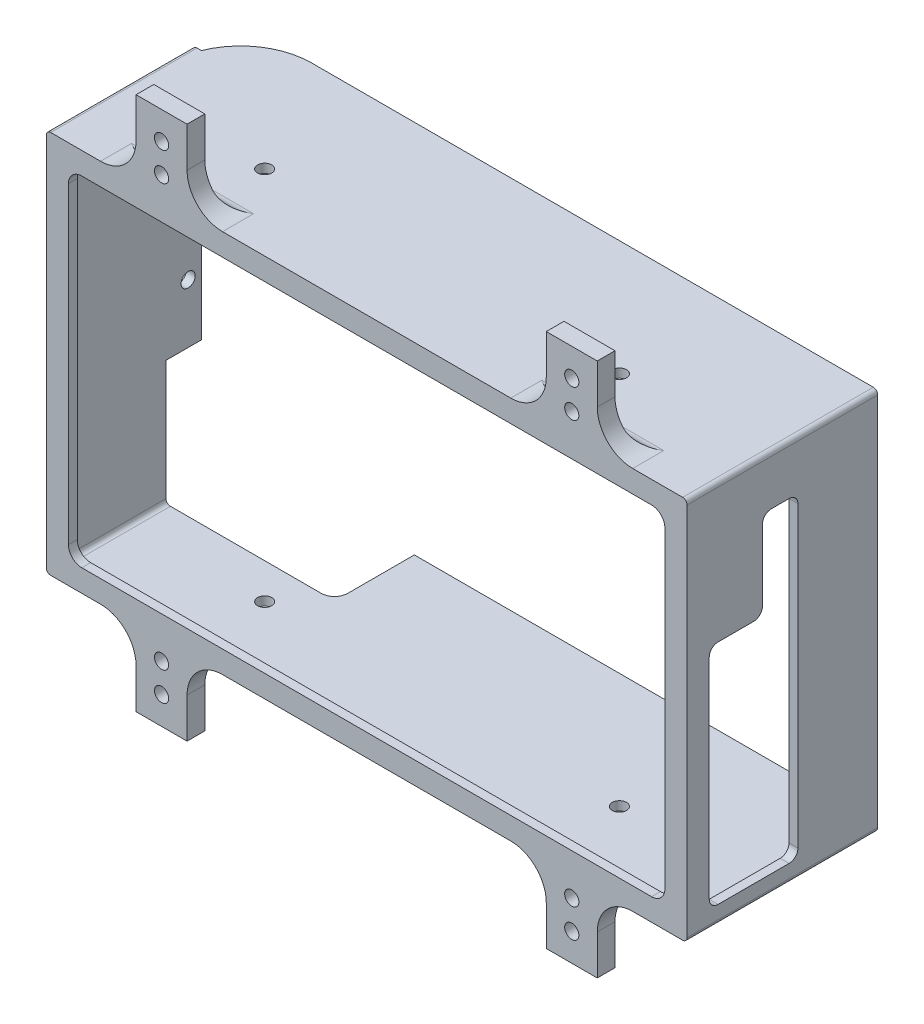
from build123d import *

# Parameters (mm, degrees)
SKETCH_1_W           = 140.5
SKETCH_1_H           = 82.5
EXTRUDE_1_DEPTH      = 2
EXTRUDE_3_DEPTH      = 41
EXTRUDE_3_DEPTH_BACK = 2
SKETCH_6_W           = 144.5
SKETCH_6_H           = 86.5
SKETCH_6_W_2         = 140.5
SKETCH_6_H_2         = 82.5
FILLET_2_R           = 1
FILLET_3_R           = 1
SKETCH_9_R           = 1.6
SKETCH_9_R_2         = 2.1
CUT_EXTRUDE_3_DEPTH  = 95.549590163
CUT_EXTRUDE_4_DEPTH  = 120.930448594
CUT_EXTRUDE_5_REACH  = 158.307
SKETCH_12_R          = 1.6
SKETCH_13_R          = 1.6
CUT_EXTRUDE_6_DEPTH  = 120.9304487
CUT_EXTRUDE_7_DEPTH  = 10
CUT_EXTRUDE_8_REACH  = 158.307
FILLET_4_R           = 2
SKETCH_18_W          = 11.5
SKETCH_18_H          = 17
EXTRUDE_4_DEPTH      = 4
CUT_EXTRUDE_9_REACH  = 103.839
SKETCH_19_R          = 1.6
CUT_EXTRUDE_11_REACH = 134.715
FILLET_5_R           = 8
FILLET_6_R           = 3
SKETCH_21_W          = 21.379411067
SKETCH_21_H          = 30
CUT_EXTRUDE_12_DEPTH = 8


with BuildPart() as part:
    # 草图1 → 凸台-拉伸1 (new body)
    with BuildSketch(Plane.XY):
        Rectangle(SKETCH_1_W, SKETCH_1_H)
    extrude(amount=EXTRUDE_1_DEPTH)

    # 草图6 → 凸台-拉伸3 (add, two sides: drawn at the far end of the back side and taken through both)
    with BuildSketch(Plane(origin=(0, 0, 0), x_dir=(-1, 0, 0), z_dir=(0, 0, -1)).offset(-EXTRUDE_3_DEPTH_BACK)):
        Rectangle(SKETCH_6_W, SKETCH_6_H)
        Rectangle(SKETCH_6_W_2, SKETCH_6_H_2, mode=Mode.SUBTRACT)
    extrude(amount=EXTRUDE_3_DEPTH + EXTRUDE_3_DEPTH_BACK)

    # 圆角2
    fillet_2_edges = [part.edges().sort_by_distance(p)[0] for p in [
        (70.25, -41.25, -20.5),
        (70.25, 41.25, -20.5),
        (-70.25, 41.25, -20.5),
        (-70.25, -41.25, -20.5),
    ]]
    fillet(fillet_2_edges, radius=FILLET_2_R)

    # 圆角3
    fillet_3_edges = [part.edges().sort_by_distance(p)[0] for p in [
        (72.25, 43.25, -19.5),
        (-72.25, 43.25, -19.5),
        (-72.25, -43.25, -19.5),
        (72.25, -43.25, -19.5),
    ]]
    fillet(fillet_3_edges, radius=FILLET_3_R)

    # 草图9 → 切除-拉伸3 (cut, through all)
    with BuildSketch(Plane.XY.offset(2)):
        with Locations((26.5, -17.5)):
            Circle(SKETCH_9_R)
        with Locations((0, -17.5)):
            Circle(SKETCH_9_R)
        with Locations((-10.5, -17)):
            Circle(SKETCH_9_R_2)
        with Locations((-26.5, -17.5)):
            Circle(SKETCH_9_R)
        with Locations((-26.5, 0)):
            Circle(SKETCH_9_R)
        with Locations((-10.5, 0)):
            Circle(SKETCH_9_R_2)
        with Locations((26.5, 0)):
            Circle(SKETCH_9_R)
        with Locations((10.5, 0)):
            Circle(SKETCH_9_R_2)
        with Locations((26.5, 17.5)):
            Circle(SKETCH_9_R)
        with Locations((0, 17.5)):
            Circle(SKETCH_9_R)
        with Locations((-10.5, 17)):
            Circle(SKETCH_9_R_2)
        with Locations((-26.5, 17.5)):
            Circle(SKETCH_9_R)
        Circle(SKETCH_9_R)
    extrude(amount=-CUT_EXTRUDE_3_DEPTH, mode=Mode.SUBTRACT)

    # 草图10 → 切除-拉伸4 (cut, through all)
    with BuildSketch(Plane(origin=(0, 43.25, 0), x_dir=(1, 0, 0), z_dir=(0, 1, 0))):
        with BuildLine():
            Line((-72.25, 31), (-72.25, 41))
            Line((-72.25, 41), (-55.417603026, 41))
            ThreePointArc((-55.417603026, 41), (-64.361874936, 38.266499161), (-70.25, 31))
            Line((-70.25, 31), (-72.25, 31))
        make_face()
    extrude(amount=-CUT_EXTRUDE_4_DEPTH, mode=Mode.SUBTRACT)

    # 草图12 → 切除-拉伸5 (cut, up to next)
    with BuildSketch(Plane.ZY.offset(72.25), mode=Mode.PRIVATE) as cut_extrude_5_sk1:
        with Locations((-28, 0)):
            Circle(SKETCH_12_R)
    cut_extrude_5_tool1 = extrude(cut_extrude_5_sk1.sketch, amount=-CUT_EXTRUDE_5_REACH, mode=Mode.PRIVATE) & part.part
    add(cut_extrude_5_tool1.solids().sort_by_distance((-72.25, 0, -28))[0], mode=Mode.SUBTRACT)

    # 草图13 → 切除-拉伸6 (cut, through all)
    with BuildSketch(Plane(origin=(0, 43.25, 0), x_dir=(1, 0, 0), z_dir=(0, 1, 0))):
        with Locations(Location((-40, 15, 0), (0, 0, 270))):
            Circle(SKETCH_13_R)
        with Locations(Location((40, 15, 0), (0, 0, 270))):
            Circle(SKETCH_13_R)
    extrude(amount=-CUT_EXTRUDE_6_DEPTH, mode=Mode.SUBTRACT)

    # 草图14 → 切除-拉伸7 (cut)
    with BuildSketch(Plane(origin=(0, 0, 0), x_dir=(-1, 0, 0), z_dir=(0, 0, -1))):
        with BuildLine():
            Line((-64.25, 38.25), (64.25, 38.25))
            ThreePointArc((64.25, 38.25), (66.371320344, 37.371320344), (67.25, 35.25))
            Line((67.25, 35.25), (67.25, -35.25))
            ThreePointArc((67.25, -35.25), (66.371320344, -37.371320344), (64.25, -38.25))
            Line((64.25, -38.25), (-64.25, -38.25))
            ThreePointArc((-64.25, -38.25), (-66.371320344, -37.371320344), (-67.25, -35.25))
            Line((-67.25, -35.25), (-67.25, 35.25))
            ThreePointArc((-67.25, 35.25), (-66.371320344, 37.371320344), (-64.25, 38.25))
        make_face()
    extrude(amount=-CUT_EXTRUDE_7_DEPTH, mode=Mode.SUBTRACT)

    # 草图15 → 切除-拉伸8 (cut, up to next)
    with BuildSketch(Plane(origin=(72.25, 0, 0), x_dir=(0, 0, -1), z_dir=(1, 0, 0)), mode=Mode.PRIVATE) as cut_extrude_8_sk1:
        Polygon((15, 12), (3, 12), (3, -39.25), (23, -39.25), (23, 32), (15, 32), align=None)
    cut_extrude_8_tool1 = extrude(cut_extrude_8_sk1.sketch, amount=-CUT_EXTRUDE_8_REACH, mode=Mode.PRIVATE) & part.part
    add(cut_extrude_8_tool1.solids().sort_by_distance((72.25, -8.814873, -13.810127))[0], mode=Mode.SUBTRACT)

    # 圆角4
    fillet_4_edges = [part.edges().sort_by_distance(p)[0] for p in [
        (71.25, -39.25, -3),
        (71.25, 12, -3),
        (71.25, 12, -15),
        (71.25, 32, -15),
        (71.25, 32, -23),
        (71.25, -39.25, -23),
    ]]
    fillet(fillet_4_edges, radius=FILLET_4_R)

    # 草图18 → 凸台-拉伸4 (add)
    with BuildSketch(Plane.XY.offset(2)):
        with Locations((-46.25, -51.75)):
            Rectangle(SKETCH_18_W, SKETCH_18_H)
        with Locations((46.25, -51.75)):
            Rectangle(SKETCH_18_W, SKETCH_18_H)
        with Locations((46.25, 51.75)):
            Rectangle(SKETCH_18_W, SKETCH_18_H)
        with Locations((-46.25, 51.75)):
            Rectangle(SKETCH_18_W, SKETCH_18_H)
    extrude(amount=-EXTRUDE_4_DEPTH)

    # 草图19 → 切除-拉伸9 (cut, up to next)
    with BuildSketch(Plane(origin=(0, 0, -2), x_dir=(-1, 0, 0), z_dir=(0, 0, -1)), mode=Mode.PRIVATE) as cut_extrude_9_sk1:
        with Locations((46.25, 54)):
            Circle(SKETCH_19_R)
    cut_extrude_9_tool1 = extrude(cut_extrude_9_sk1.sketch, amount=-CUT_EXTRUDE_9_REACH, mode=Mode.PRIVATE) & part.part
    # 草图19 → 切除-拉伸9 (cut, up to next)
    with BuildSketch(Plane(origin=(0, 0, -2), x_dir=(-1, 0, 0), z_dir=(0, 0, -1)), mode=Mode.PRIVATE) as cut_extrude_9_sk2:
        with Locations((46.25, 47.5)):
            Circle(SKETCH_19_R)
    cut_extrude_9_tool2 = extrude(cut_extrude_9_sk2.sketch, amount=-CUT_EXTRUDE_9_REACH, mode=Mode.PRIVATE) & part.part
    # 草图19 → 切除-拉伸9 (cut, up to next)
    with BuildSketch(Plane(origin=(0, 0, -2), x_dir=(-1, 0, 0), z_dir=(0, 0, -1)), mode=Mode.PRIVATE) as cut_extrude_9_sk3:
        with Locations((46.25, -47.5)):
            Circle(SKETCH_19_R)
    cut_extrude_9_tool3 = extrude(cut_extrude_9_sk3.sketch, amount=-CUT_EXTRUDE_9_REACH, mode=Mode.PRIVATE) & part.part
    # 草图19 → 切除-拉伸9 (cut, up to next)
    with BuildSketch(Plane(origin=(0, 0, -2), x_dir=(-1, 0, 0), z_dir=(0, 0, -1)), mode=Mode.PRIVATE) as cut_extrude_9_sk4:
        with Locations((46.25, -54)):
            Circle(SKETCH_19_R)
    cut_extrude_9_tool4 = extrude(cut_extrude_9_sk4.sketch, amount=-CUT_EXTRUDE_9_REACH, mode=Mode.PRIVATE) & part.part
    # 草图19 → 切除-拉伸9 (cut, up to next)
    with BuildSketch(Plane(origin=(0, 0, -2), x_dir=(-1, 0, 0), z_dir=(0, 0, -1)), mode=Mode.PRIVATE) as cut_extrude_9_sk5:
        with Locations((-46.25, -54)):
            Circle(SKETCH_19_R)
    cut_extrude_9_tool5 = extrude(cut_extrude_9_sk5.sketch, amount=-CUT_EXTRUDE_9_REACH, mode=Mode.PRIVATE) & part.part
    # 草图19 → 切除-拉伸9 (cut, up to next)
    with BuildSketch(Plane(origin=(0, 0, -2), x_dir=(-1, 0, 0), z_dir=(0, 0, -1)), mode=Mode.PRIVATE) as cut_extrude_9_sk6:
        with Locations((-46.25, -47.5)):
            Circle(SKETCH_19_R)
    cut_extrude_9_tool6 = extrude(cut_extrude_9_sk6.sketch, amount=-CUT_EXTRUDE_9_REACH, mode=Mode.PRIVATE) & part.part
    # 草图19 → 切除-拉伸9 (cut, up to next)
    with BuildSketch(Plane(origin=(0, 0, -2), x_dir=(-1, 0, 0), z_dir=(0, 0, -1)), mode=Mode.PRIVATE) as cut_extrude_9_sk7:
        with Locations((-46.25, 47.5)):
            Circle(SKETCH_19_R)
    cut_extrude_9_tool7 = extrude(cut_extrude_9_sk7.sketch, amount=-CUT_EXTRUDE_9_REACH, mode=Mode.PRIVATE) & part.part
    # 草图19 → 切除-拉伸9 (cut, up to next)
    with BuildSketch(Plane(origin=(0, 0, -2), x_dir=(-1, 0, 0), z_dir=(0, 0, -1)), mode=Mode.PRIVATE) as cut_extrude_9_sk8:
        with Locations((-46.25, 54)):
            Circle(SKETCH_19_R)
    cut_extrude_9_tool8 = extrude(cut_extrude_9_sk8.sketch, amount=-CUT_EXTRUDE_9_REACH, mode=Mode.PRIVATE) & part.part
    add(cut_extrude_9_tool1.solids().sort_by_distance((-46.25, 54, -2))[0], mode=Mode.SUBTRACT)
    add(cut_extrude_9_tool2.solids().sort_by_distance((-46.25, 47.5, -2))[0], mode=Mode.SUBTRACT)
    add(cut_extrude_9_tool3.solids().sort_by_distance((-46.25, -47.5, -2))[0], mode=Mode.SUBTRACT)
    add(cut_extrude_9_tool4.solids().sort_by_distance((-46.25, -54, -2))[0], mode=Mode.SUBTRACT)
    add(cut_extrude_9_tool5.solids().sort_by_distance((46.25, -54, -2))[0], mode=Mode.SUBTRACT)
    add(cut_extrude_9_tool6.solids().sort_by_distance((46.25, -47.5, -2))[0], mode=Mode.SUBTRACT)
    add(cut_extrude_9_tool7.solids().sort_by_distance((46.25, 47.5, -2))[0], mode=Mode.SUBTRACT)
    add(cut_extrude_9_tool8.solids().sort_by_distance((46.25, 54, -2))[0], mode=Mode.SUBTRACT)

    # 草图20 → 切除-拉伸11 (cut, up to next)
    with BuildSketch(Plane.XZ.offset(43.25), mode=Mode.PRIVATE) as cut_extrude_11_sk1:
        with BuildLine():
            Line((-35.25, -49.316072208), (-67.25, -49.316072208))
            ThreePointArc((-67.25, -49.316072208), (-69.371320344, -48.437392552), (-70.25, -46.316072208))
            Line((-70.25, -46.316072208), (-70.25, -23))
            Line((-70.25, -23), (-35.25, -23))
            ThreePointArc((-35.25, -23), (-33.128679656, -23.878679656), (-32.25, -26))
            Line((-32.25, -26), (-32.25, -46.316072208))
            ThreePointArc((-32.25, -46.316072208), (-33.128679656, -48.437392552), (-35.25, -49.316072208))
        make_face()
    cut_extrude_11_tool1 = extrude(cut_extrude_11_sk1.sketch, amount=-CUT_EXTRUDE_11_REACH, mode=Mode.PRIVATE) & part.part
    add(cut_extrude_11_tool1.solids().sort_by_distance((-51.285609, -43.25, -36.133776))[0], mode=Mode.SUBTRACT)

    # 圆角5
    fillet_5_edges = [part.edges().sort_by_distance(p)[0] for p in [
        (-40.5, -43.25, 0),
        (-52, -43.25, 0),
        (40.5, -43.25, 0),
        (52, -43.25, 0),
        (40.5, 43.25, 0),
        (52, 43.25, 0),
        (-40.5, 43.25, 0),
        (-52, 43.25, 0),
    ]]
    fillet(fillet_5_edges, radius=FILLET_5_R)

    # 圆角6
    fillet_6_edges = [part.edges().sort_by_distance(p)[0] for p in [
        (-46.25, -43.25, -2),
        (46.25, -43.25, -2),
        (46.25, 43.25, -2),
        (-46.25, 43.25, -2),
    ]]
    fillet(fillet_6_edges, radius=FILLET_6_R)

    # 草图21 → 切除-拉伸12 (cut)
    with BuildSketch(Plane(origin=(0, 0, -31), x_dir=(-1, 0, 0), z_dir=(0, 0, -1))):
        with Locations((72.29531572, -28.25)):
            Rectangle(SKETCH_21_W, SKETCH_21_H)
    extrude(amount=-CUT_EXTRUDE_12_DEPTH, mode=Mode.SUBTRACT)


solid = part.part
